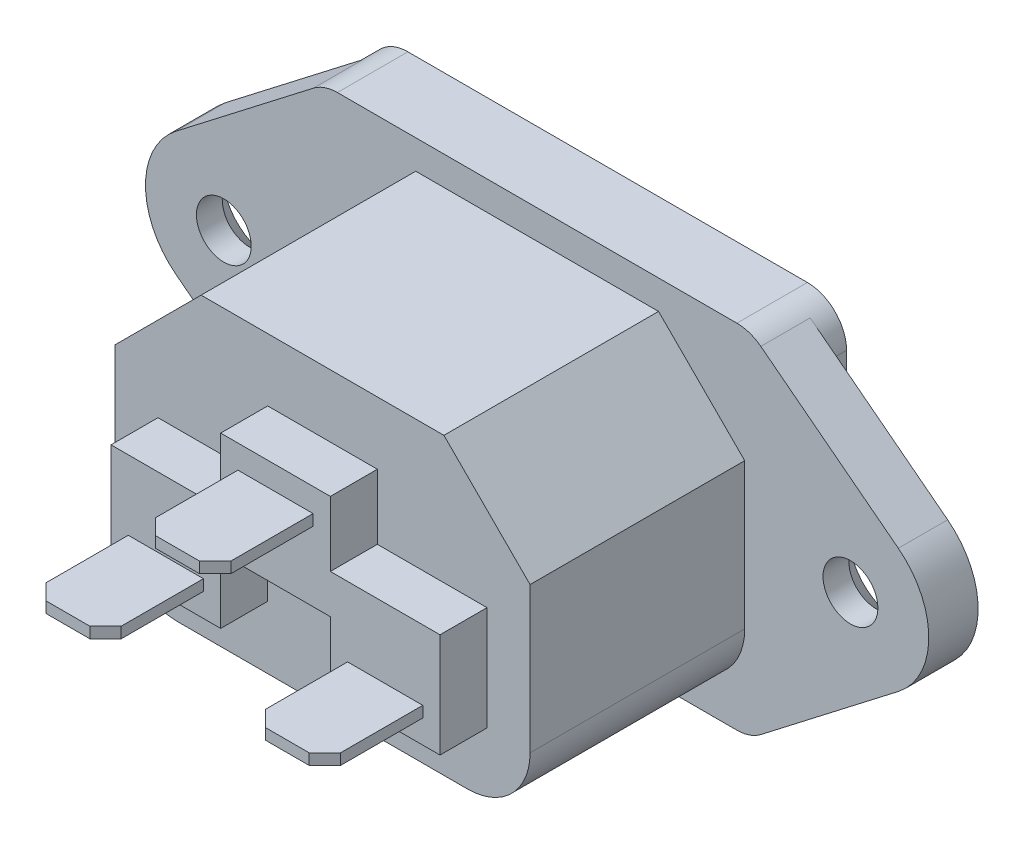
from build123d import *

# Parameters (mm, degrees)
SKETCH1_R      = 1.75
EXTRUDE1_DEPTH = 3.15
CHAMFER1_SIZE  = 1.5
EXTRUDE2_START = 1.35
EXTRUDE2_DEPTH = 1.35
EXTRUDE3_DEPTH = 13.7
EXTRUDE4_DEPTH = 3
SKETCH5_W      = 4.8
SKETCH5_H      = 0.7
EXTRUDE5_DEPTH = 6.25
CHAMFER2_SIZE  = 1
EXTRUDE6_DEPTH = 17
FILLET1_R      = 0.5
SKETCH7_W      = 2
SKETCH7_H      = 4
EXTRUDE7_DEPTH = 14
SKETCH8_W      = 2
SKETCH8_H      = 4
EXTRUDE8_DEPTH = 16.5
CHAMFER3_SIZE  = 0.75


with BuildPart() as part:
    # Sketch1 → Extrude1 (new body)
    with BuildSketch(Plane.XY):
        with BuildLine():
            Line((-12.75, 11.25), (12.75, 11.25))
            ThreePointArc((12.75, 11.25), (13.556623081, 11.116296517), (14.276967509, 10.729487365))
            Line((14.276967509, 10.729487365), (23.053935018, 3.958974729))
            ThreePointArc((23.053935018, 3.958974729), (25, 0), (23.053935018, -3.958974729))
            Line((23.053935018, -3.958974729), (14.276967509, -10.729487365))
            ThreePointArc((14.276967509, -10.729487365), (13.556623081, -11.116296517), (12.75, -11.25))
            Line((12.75, -11.25), (-12.75, -11.25))
            ThreePointArc((-12.75, -11.25), (-13.556623081, -11.116296517), (-14.276967509, -10.729487365))
            Line((-14.276967509, -10.729487365), (-23.053935018, -3.958974729))
            ThreePointArc((-23.053935018, -3.958974729), (-25, 0), (-23.053935018, 3.958974729))
            Line((-23.053935018, 3.958974729), (-14.276967509, 10.729487365))
            ThreePointArc((-14.276967509, 10.729487365), (-13.556623081, 11.116296517), (-12.75, 11.25))
        make_face()
        with Locations((-20, 0)):
            Circle(SKETCH1_R, mode=Mode.SUBTRACT)
        with Locations((20, 0)):
            Circle(SKETCH1_R, mode=Mode.SUBTRACT)
    extrude(amount=EXTRUDE1_DEPTH)

    # Chamfer1
    chamfer1_edges = [part.edges().sort_by_distance(p)[0] for p in [
        (-21.75, 0, 0),
        (18.25, 0, 0),
    ]]
    chamfer(chamfer1_edges, length=CHAMFER1_SIZE)

    # Sketch2 → Extrude2 (add)
    with BuildSketch(Plane(origin=(0, 0, 0), x_dir=(-1, 0, 0), z_dir=(0, 0, -1)).offset(EXTRUDE2_START)):
        with BuildLine():
            Line((-12.75, 11.25), (12.75, 11.25))
            ThreePointArc((12.75, 11.25), (14.517766953, 10.517766953), (15.25, 8.75))
            Line((15.25, 8.75), (15.25, -8.75))
            ThreePointArc((15.25, -8.75), (14.517766953, -10.517766953), (12.75, -11.25))
            Line((12.75, -11.25), (-12.75, -11.25))
            ThreePointArc((-12.75, -11.25), (-14.517766953, -10.517766953), (-15.25, -8.75))
            Line((-15.25, -8.75), (-15.25, 8.75))
            ThreePointArc((-15.25, 8.75), (-14.517766953, 10.517766953), (-12.75, 11.25))
        make_face()
    extrude(amount=-EXTRUDE2_DEPTH)

    # Sketch3 → Extrude3 (add)
    with BuildSketch(Plane.XY.offset(3.15)):
        with BuildLine():
            Line((-7.75, 9.4), (7.75, 9.4))
            Line((7.75, 9.4), (13.25, 3.9))
            Line((13.25, 3.9), (13.25, -5.4))
            ThreePointArc((13.25, -5.4), (12.078427125, -8.228427125), (9.25, -9.4))
            Line((9.25, -9.4), (-9.25, -9.4))
            ThreePointArc((-9.25, -9.4), (-12.078427125, -8.228427125), (-13.25, -5.4))
            Line((-13.25, -5.4), (-13.25, 3.9))
            Line((-13.25, 3.9), (-7.75, 9.4))
        make_face()
    extrude(amount=EXTRUDE3_DEPTH)

    # Sketch4 → Extrude4 (add)
    with BuildSketch(Plane.XY.offset(16.85)):
        Polygon((-10.5, 1.25), (-3.5, 1.25), (-3.5, 5.4), (3.5, 5.4), (3.5, 1.25), (10.5, 1.25), (10.5, -5.4), (3.5, -5.4), (3.5, -1.25), (-3.5, -1.25), (-3.5, -5.4), (-10.5, -5.4), align=None)
    extrude(amount=EXTRUDE4_DEPTH)

    # Sketch5 → Extrude5 (add)
    with BuildSketch(Plane.XY.offset(19.85)):
        with Locations((0, 3.55)):
            Rectangle(SKETCH5_W, SKETCH5_H)
        with Locations((7, -3.55)):
            Rectangle(SKETCH5_W, SKETCH5_H)
        with Locations((-7, -3.55)):
            Rectangle(SKETCH5_W, SKETCH5_H)
    extrude(amount=EXTRUDE5_DEPTH)

    # Chamfer2
    chamfer2_edges = [part.edges().sort_by_distance(p)[0] for p in [
        (-2.4, 3.55, 26.1),
        (2.4, 3.55, 26.1),
        (4.6, -3.55, 26.1),
        (9.4, -3.55, 26.1),
        (-9.4, -3.55, 26.1),
        (-4.6, -3.55, 26.1),
    ]]
    chamfer(chamfer2_edges, length=CHAMFER2_SIZE)

    # Sketch6 → Extrude6 (cut)
    with BuildSketch(Plane(origin=(0, 0, -1.35), x_dir=(-1, 0, 0), z_dir=(0, 0, -1))):
        with BuildLine():
            Line((-6.7, 7.85), (6.7, 7.85))
            Line((6.7, 7.85), (12.2, 2.35))
            Line((12.2, 2.35), (12.2, -5.35))
            ThreePointArc((12.2, -5.35), (11.467766953, -7.117766953), (9.7, -7.85))
            Line((9.7, -7.85), (-9.7, -7.85))
            ThreePointArc((-9.7, -7.85), (-11.467766953, -7.117766953), (-12.2, -5.35))
            Line((-12.2, -5.35), (-12.2, 2.35))
            Line((-12.2, 2.35), (-6.7, 7.85))
        make_face()
    extrude(amount=-EXTRUDE6_DEPTH, mode=Mode.SUBTRACT)

    # Fillet1
    fillet1_edges = [part.edges().sort_by_distance(p)[0] for p in [
        (9.45, 5.1, -1.35),
        (12.2, -1.5, -1.35),
        (11.467766953, -7.117766953, -1.35),
        (0, -7.85, -1.35),
        (-11.467766953, -7.117766953, -1.35),
        (-12.2, -1.5, -1.35),
        (-9.45, 5.1, -1.35),
        (0, 7.85, -1.35),
    ]]
    fillet(fillet1_edges, radius=FILLET1_R)

    # Sketch7 → Extrude7 (add)
    with BuildSketch(Plane(origin=(0, 0, 15.65), x_dir=(-1, 0, 0), z_dir=(0, 0, -1))):
        with Locations((-7, -2)):
            Rectangle(SKETCH7_W, SKETCH7_H)
        with Locations((7, -2)):
            Rectangle(SKETCH7_W, SKETCH7_H)
    extrude(amount=EXTRUDE7_DEPTH)

    # Sketch8 → Extrude8 (add)
    with BuildSketch(Plane(origin=(0, 0, 15.65), x_dir=(-1, 0, 0), z_dir=(0, 0, -1))):
        with Locations((0, 2)):
            Rectangle(SKETCH8_W, SKETCH8_H)
    extrude(amount=EXTRUDE8_DEPTH)

    # Chamfer3
    chamfer3_edges = [part.edges().sort_by_distance(p)[0] for p in [
        (8, -2, 1.65),
        (7, -4, 1.65),
        (6, -2, 1.65),
        (7, 0, 1.65),
        (-6, -2, 1.65),
        (-7, -4, 1.65),
        (-8, -2, 1.65),
        (-7, 0, 1.65),
        (1, 2, -0.85),
        (0, 0, -0.85),
        (-1, 2, -0.85),
        (0, 4, -0.85),
    ]]
    chamfer(chamfer3_edges, length=CHAMFER3_SIZE)


solid = part.part
